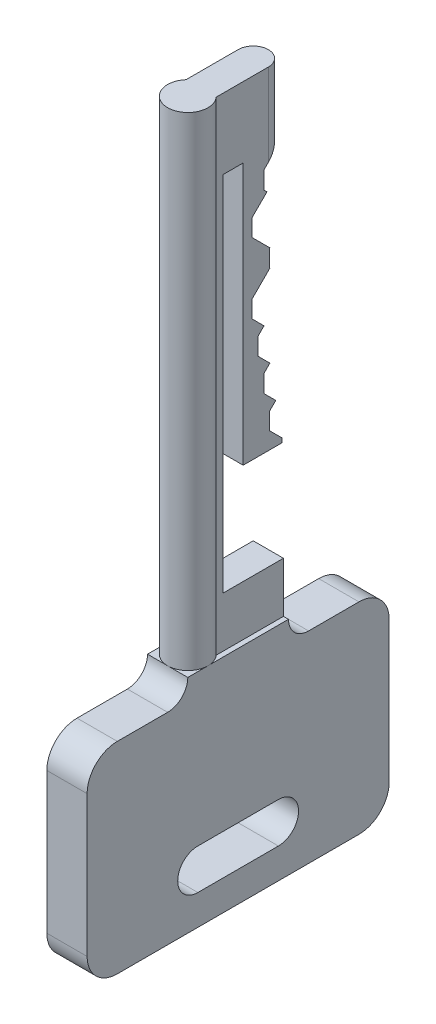
from build123d import *

# Parameters (mm, degrees)
BOSS_EXTRUDE2_DEPTH      = 1.5
BOSS_EXTRUDE2_DEPTH_BACK = 1.5
SKETCH2_R                = 2
BOSS_EXTRUDE3_DEPTH      = 48
BOSS_EXTRUDE4_DEPTH      = 0.5
BOSS_EXTRUDE4_DEPTH_BACK = 3.5
CUT_EXTRUDE1_DEPTH       = 3
CUT_EXTRUDE2_DEPTH       = 26.3039
FILLET1_R                = 1
CUT_EXTRUDE4_REACH       = 74.305
CUT_EXTRUDE5_REACH       = 43.195
SKETCH10_W               = 3
SKETCH10_H               = 0.141883177


with BuildPart() as part:
    # Sketch1 → Boss-Extrude2 (new, two sides: drawn at the far end of the back side and taken through both)
    with BuildSketch(Plane(origin=(0, 108.422012546, -620.347507802), x_dir=(0, 0, -1), z_dir=(1, 0, 0)).offset(-BOSS_EXTRUDE2_DEPTH_BACK)):
        Polygon((-620.347507802, -60.422012546), (-620.347507802, -108.422012546), (-612.347507802, -108.422012546), (-612.347507802, -103.422012546), (-618.347507802, -103.422012546), (-618.347507802, -67.422012546), (-616.347507802, -67.422012546), (-616.347507802, -93.422012546), (-612.347507802, -93.422012546), (-612.347507802, -64.422012546), (-612.347507802, -60.422012546), align=None)
    extrude(amount=BOSS_EXTRUDE2_DEPTH + BOSS_EXTRUDE2_DEPTH_BACK)

    # Sketch2 → Boss-Extrude3 (add)
    with BuildSketch(Plane(origin=(0, 48, 0), x_dir=(1, 0, 0), z_dir=(0, 1, 0))):
        Circle(SKETCH2_R)
    extrude(amount=-BOSS_EXTRUDE3_DEPTH)

    # Sketch4 → Boss-Extrude4 (add, two sides: drawn at the far end of the back side and taken through both)
    with BuildSketch(Plane.ZY.offset(1.5).offset(-BOSS_EXTRUDE4_DEPTH_BACK)):
        with BuildLine():
            Line((-8, 0), (2, 0))
            ThreePointArc((2, 0), (2.585786438, -1.414213562), (4, -2))
            Line((4, -2), (9, -2))
            ThreePointArc((9, -2), (11.121320344, -2.878679656), (12, -5))
            Line((12, -5), (12, -19))
            ThreePointArc((12, -19), (11.121320344, -21.121320344), (9, -22))
            Line((9, -22), (-15, -22))
            ThreePointArc((-15, -22), (-17.121320344, -21.121320344), (-18, -19))
            Line((-18, -19), (-18, -5))
            ThreePointArc((-18, -5), (-17.121320344, -2.878679656), (-15, -2))
            Line((-15, -2), (-10, -2))
            ThreePointArc((-10, -2), (-8.585786438, -1.414213562), (-8, 0))
        make_face()
        with BuildLine():
            Line((-7, -15), (1, -15))
            ThreePointArc((1, -15), (3, -17), (1, -19))
            Line((1, -19), (-7, -19))
            ThreePointArc((-7, -19), (-9, -17), (-7, -15))
        make_face(mode=Mode.SUBTRACT)
    extrude(amount=BOSS_EXTRUDE4_DEPTH + BOSS_EXTRUDE4_DEPTH_BACK)

    # Sketch6 → Cut-Extrude1 (cut)
    with BuildSketch(Plane.ZY.offset(1.5)):
        Polygon((-6.6312, 18.3509), (-6.6312, 16.6491), (-8.2803, 15), (-10.2803, 15), (-10.2803, 41.5842), (-8.2803, 41.5842), (-6.047, 39.3509), (-6.047, 37.6491), (-6.3619, 37.3342), (-4.8786, 35.8509), (-4.8786, 34.1491), (-6.654, 32.3737), (-6.6312, 32.3509), (-6.6312, 30.6491), (-6.654, 30.6263), (-4.8786, 28.8509), (-4.8786, 27.1491), (-6.0698, 25.9579), (-5.4628, 25.3509), (-5.4628, 23.6491), (-6.654, 22.4579), (-6.047, 21.8509), (-6.047, 20.1491), (-7.2382, 18.9579), align=None)
    extrude(amount=-CUT_EXTRUDE1_DEPTH, mode=Mode.SUBTRACT)

    # Sketch7 → Cut-Extrude2 (cut)
    with BuildSketch(Plane.XZ.offset(-15)):
        Polygon((0, -6.6312), (-1.5, -5.1312), (-1.5, -8), (0, -8), align=None)
    extrude(amount=-CUT_EXTRUDE2_DEPTH, mode=Mode.SUBTRACT)

    # Fillet1
    fillet1_edges = [part.edges().sort_by_distance(p)[0] for p in [
        (0, 41.3039, -7.3156),
    ]]
    fillet(fillet1_edges, radius=FILLET1_R)

    # Cut-Extrude4: up to this plane
    cut_extrude4_end = Plane(origin=(28.627440951, 39.3509, -6.047), z_dir=(2.4829835882571804e-15, 0.7071067811865529, 0.7071067811865422))
    # Sketch9 → Cut-Extrude4 (cut, up to the surface)
    with BuildSketch(Plane(origin=(0, 48, 0), x_dir=(1, 0, 0), z_dir=(0, 1, 0)), mode=Mode.PRIVATE) as cut_extrude4_sk1:
        with BuildLine():
            ThreePointArc((-1.5, 6.5), (-1.060660172, 7.560660172), (0, 8))
            Line((0, 8), (-1.5, 8))
            Line((-1.5, 8), (-1.5, 6.5))
        make_face()
    cut_extrude4_tool1 = split(extrude(cut_extrude4_sk1.sketch, amount=-CUT_EXTRUDE4_REACH, mode=Mode.PRIVATE), bisect_by=cut_extrude4_end, keep=Keep.BOTH, mode=Mode.PRIVATE)
    add(cut_extrude4_tool1.solids().sort_by_distance((-1.164948, 48, -7.664948))[0], mode=Mode.SUBTRACT)
    # Sketch9 → Cut-Extrude4 (cut, up to the surface)
    with BuildSketch(Plane(origin=(0, 48, 0), x_dir=(1, 0, 0), z_dir=(0, 1, 0)), mode=Mode.PRIVATE) as cut_extrude4_sk2:
        with BuildLine():
            Line((1.5, 6.5), (1.5, 8))
            Line((1.5, 8), (0, 8))
            ThreePointArc((0, 8), (1.060660172, 7.560660172), (1.5, 6.5))
        make_face()
    cut_extrude4_tool2 = split(extrude(cut_extrude4_sk2.sketch, amount=-CUT_EXTRUDE4_REACH, mode=Mode.PRIVATE), bisect_by=cut_extrude4_end, keep=Keep.BOTH, mode=Mode.PRIVATE)
    add(cut_extrude4_tool2.solids().sort_by_distance((1.164948, 48, -7.664948))[0], mode=Mode.SUBTRACT)

    # Cut-Extrude5: up to this plane
    cut_extrude5_end = Plane(origin=(28.627440951, 16.6491, -6.6312), z_dir=(2.462807656596698e-15, -0.707106781186546, 0.707106781186549))
    # Sketch10 → Cut-Extrude5 (cut, up to the surface)
    with BuildSketch(Plane(origin=(0, 15, 0), x_dir=(1, 0, 0), z_dir=(0, 1, 0)), mode=Mode.PRIVATE) as cut_extrude5_sk1:
        with Locations((0, 7.929058411)):
            Rectangle(SKETCH10_W, SKETCH10_H)
    cut_extrude5_tool1 = split(extrude(cut_extrude5_sk1.sketch, amount=CUT_EXTRUDE5_REACH, mode=Mode.PRIVATE), bisect_by=cut_extrude5_end, keep=Keep.BOTH, mode=Mode.PRIVATE)
    add(cut_extrude5_tool1.solids().sort_by_distance((0, 15, -7.929058))[0], mode=Mode.SUBTRACT)


solid = part.part
